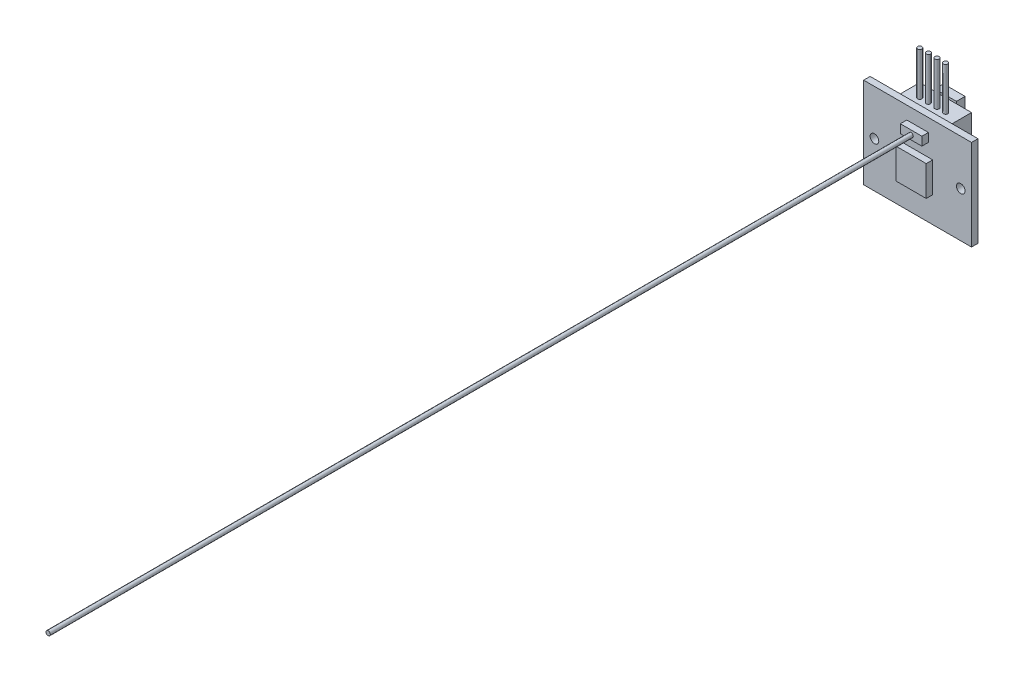
from build123d import *

# Parameters (mm, degrees)
ESQUISSE1_W          = 25
ESQUISSE1_H          = 21
ESQUISSE1_R          = 1
BOSS_EXTRU_1_DEPTH   = 1.5
ESQUISSE2_W          = 12
ESQUISSE2_H          = 10
BOSS_EXTRU_2_DEPTH   = 5
ESQUISSE3_W          = 5
ESQUISSE3_H          = 2
BOSS_EXTRU_3_DEPTH   = 1.5
ESQUISSE3_W_2        = 7
ESQUISSE3_H_2        = 7
BOSS_EXTRU_3_2_DEPTH = 1.5
ESQUISSE4_W          = 5
ESQUISSE4_H          = 8
BOSS_EXTRU_4_DEPTH   = 2
ESQUISSE5_R          = 0.5
BOSS_EXTRU_5_DEPTH   = 10
BOSS_EXTRU_5_2_DEPTH = 10
BOSS_EXTRU_5_3_DEPTH = 10
BOSS_EXTRU_5_4_DEPTH = 10
ESQUISSE6_R          = 0.5
BOSS_EXTRU_6_DEPTH   = 200


with BuildPart() as part:
    # Esquisse1 → Boss.-Extru.1 (new body)
    with BuildSketch(Plane.XY):
        Rectangle(ESQUISSE1_W, ESQUISSE1_H)
        with Locations((-10, 0)):
            Circle(ESQUISSE1_R, mode=Mode.SUBTRACT)
        with Locations(Location((10, 0, 0), (0, 0, 180))):
            Circle(ESQUISSE1_R, mode=Mode.SUBTRACT)
    extrude(amount=BOSS_EXTRU_1_DEPTH)


with BuildPart() as body_2:
    # Esquisse2 → Boss.-Extru.2 (new body)
    with BuildSketch(Plane(origin=(0, 0, 0), x_dir=(-1, 0, 0), z_dir=(0, 0, -1))):
        with Locations((0, 5)):
            Rectangle(ESQUISSE2_W, ESQUISSE2_H)
    extrude(amount=BOSS_EXTRU_2_DEPTH)

    # Esquisse4 → Boss.-Extru.4 (add)
    with BuildSketch(Plane(origin=(0, 0, -5), x_dir=(-1, 0, 0), z_dir=(0, 0, -1))):
        with Locations((0, 6.5)):
            Rectangle(ESQUISSE4_W, ESQUISSE4_H)
    extrude(amount=BOSS_EXTRU_4_DEPTH)


with BuildPart() as body_3:
    # Esquisse3 → Boss.-Extru.3 (new body)
    with BuildSketch(Plane.XY.offset(1.5)):
        with Locations((0, 6.5)):
            Rectangle(ESQUISSE3_W, ESQUISSE3_H)
    extrude(amount=BOSS_EXTRU_3_DEPTH)


with BuildPart() as body_4:
    # Esquisse3 → Boss.-Extru.3 2 (new body)
    with BuildSketch(Plane.XY.offset(1.5)):
        with Locations((0, -1)):
            Rectangle(ESQUISSE3_W_2, ESQUISSE3_H_2)
    extrude(amount=BOSS_EXTRU_3_2_DEPTH)


with BuildPart() as body_5:
    # Esquisse5 → Boss.-Extru.5 (new body)
    with BuildSketch(Plane(origin=(0, 10, 0), x_dir=(1, 0, 0), z_dir=(0, 1, 0))):
        with Locations(Location((-3, 2, 0), (0, 0, 180))):
            Circle(ESQUISSE5_R)
    extrude(amount=BOSS_EXTRU_5_DEPTH)


with BuildPart() as body_6:
    # Esquisse5 → Boss.-Extru.5 2 (new body)
    with BuildSketch(Plane(origin=(0, 10, 0), x_dir=(1, 0, 0), z_dir=(0, 1, 0))):
        with Locations(Location((-1, 2, 0), (0, 0, 180))):
            Circle(ESQUISSE5_R)
    extrude(amount=BOSS_EXTRU_5_2_DEPTH)


with BuildPart() as body_7:
    # Esquisse5 → Boss.-Extru.5 3 (new body)
    with BuildSketch(Plane(origin=(0, 10, 0), x_dir=(1, 0, 0), z_dir=(0, 1, 0))):
        with Locations(Location((1, 2, 0), (0, 0, 180))):
            Circle(ESQUISSE5_R)
    extrude(amount=BOSS_EXTRU_5_3_DEPTH)


with BuildPart() as body_8:
    # Esquisse5 → Boss.-Extru.5 4 (new body)
    with BuildSketch(Plane(origin=(0, 10, 0), x_dir=(1, 0, 0), z_dir=(0, 1, 0))):
        with Locations(Location((3, 2, 0), (0, 0, 180))):
            Circle(ESQUISSE5_R)
    extrude(amount=BOSS_EXTRU_5_4_DEPTH)


with BuildPart() as body_9:
    # Esquisse6 → Boss.-Extru.6 (new body)
    with BuildSketch(Plane.XY.offset(3)):
        with Locations((0, 6.5)):
            Circle(ESQUISSE6_R)
    extrude(amount=BOSS_EXTRU_6_DEPTH)


solid = Compound([part.part, body_2.part, body_3.part, body_4.part, body_5.part, body_6.part, body_7.part, body_8.part, body_9.part])
